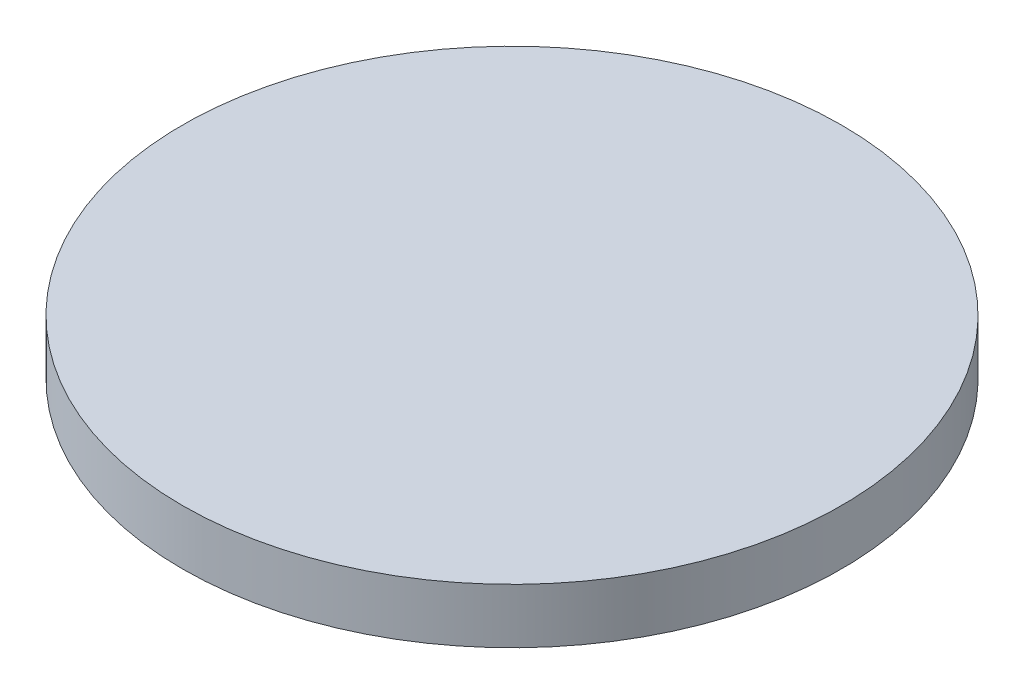
from build123d import *

# Parameters (mm, degrees)
SKETCH1_W = 24
SKETCH1_H = 4


with BuildPart() as part:
    # Sketch1 → Revolve1 (revolve)
    with BuildSketch(Plane.XY, mode=Mode.PRIVATE) as revolve1_sk:
        with Locations((-12, 2)):
            Rectangle(SKETCH1_W, SKETCH1_H)
    revolve(revolve1_sk.sketch.rotate(Axis((0, 0, 0), (0, 1, 0)), 270), axis=Axis((0, 0, 0), (0, 1, 0)))


solid = part.part
